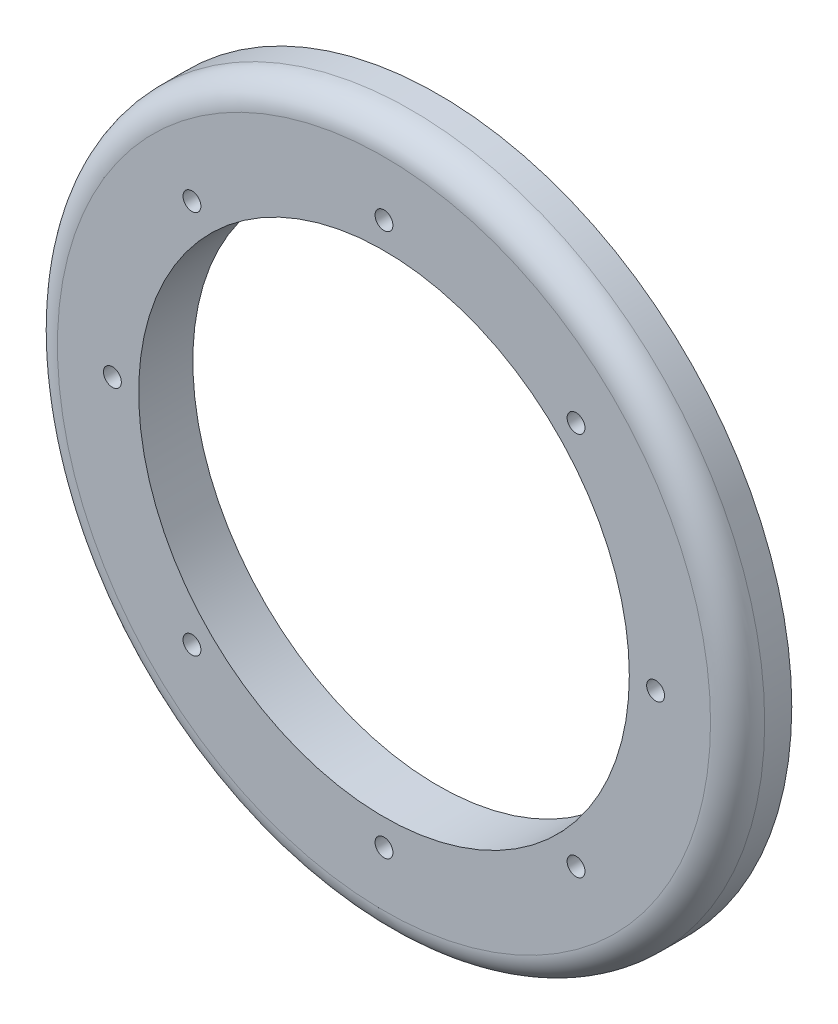
from build123d import *

# Parameters (mm, degrees)
SKETCH1_R           = 65.3
SKETCH1_R_2         = 45.3
SKETCH1_R_3         = 1.65
BOSS_EXTRUDE1_DEPTH = 10
FILLET1_R           = 5


with BuildPart() as part:
    # Sketch1 → Boss-Extrude1 (new body)
    with BuildSketch(Plane.XY):
        Circle(SKETCH1_R)
        Circle(SKETCH1_R_2, mode=Mode.SUBTRACT)
        with Locations((35.461405077, -35.461405077)):
            Circle(SKETCH1_R_3, mode=Mode.SUBTRACT)
        with Locations((0, -50.15)):
            Circle(SKETCH1_R_3, mode=Mode.SUBTRACT)
        with Locations((-35.461405077, -35.461405077)):
            Circle(SKETCH1_R_3, mode=Mode.SUBTRACT)
        with Locations((-50.15, 0)):
            Circle(SKETCH1_R_3, mode=Mode.SUBTRACT)
        with Locations((-35.461405077, 35.461405077)):
            Circle(SKETCH1_R_3, mode=Mode.SUBTRACT)
        with Locations((0, 50.15)):
            Circle(SKETCH1_R_3, mode=Mode.SUBTRACT)
        with Locations((35.461405077, 35.461405077)):
            Circle(SKETCH1_R_3, mode=Mode.SUBTRACT)
        with Locations((50.15, 0)):
            Circle(SKETCH1_R_3, mode=Mode.SUBTRACT)
    extrude(amount=BOSS_EXTRUDE1_DEPTH)

    # Fillet1
    fillet1_edges = [part.edges().sort_by_distance(p)[0] for p in [
        (-65.3, 0, 10),
    ]]
    fillet(fillet1_edges, radius=FILLET1_R)


solid = part.part
